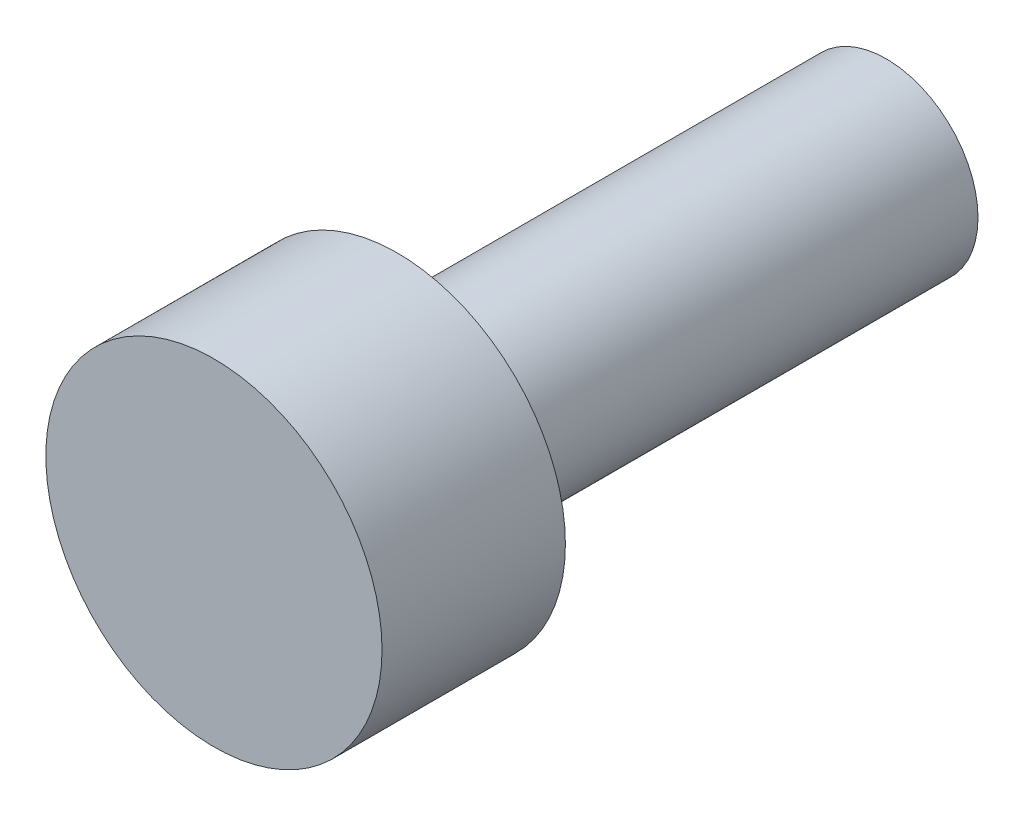
from build123d import *

# Parameters (mm, degrees)
NOMINAL_SHANK_START    = -8
SKETCH_NOMINAL_SHANK_R = 1.5
NOMINAL_SHANK_DEPTH    = 8
SKETCH_HEAD_R          = 2.75
HEAD_DEPTH             = 3


with BuildPart() as part:
    # Sketch_Nominal_shank → Nominal_shank (new body)
    with BuildSketch(Plane.XY.offset(NOMINAL_SHANK_START)):
        Circle(SKETCH_NOMINAL_SHANK_R)
    extrude(amount=NOMINAL_SHANK_DEPTH)

    # Sketch_Head → Head (add)
    with BuildSketch(Plane.XY):
        Circle(SKETCH_HEAD_R)
    extrude(amount=HEAD_DEPTH)


solid = part.part
